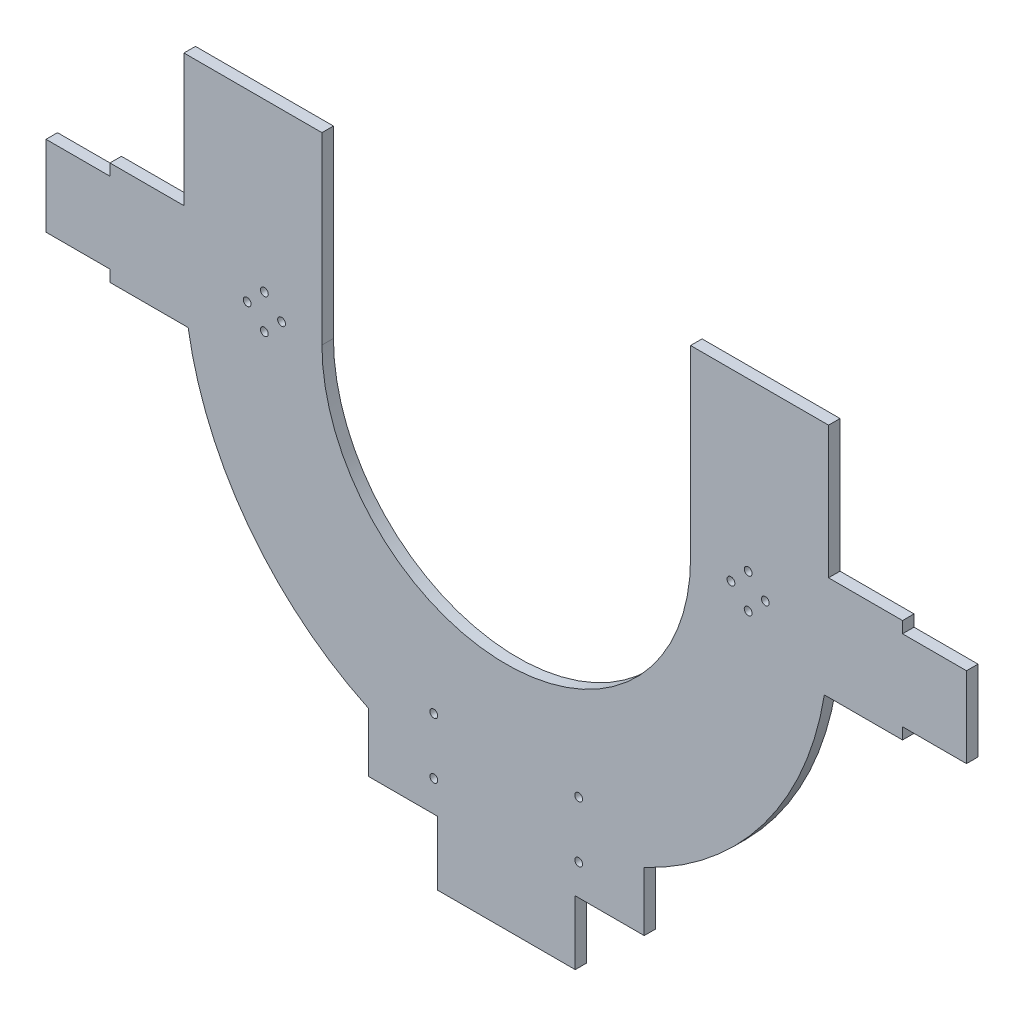
from build123d import *

# Parameters (mm, degrees)
BOSS_EXTRUDE1_DEPTH     = 3.175
SKETCH3_R               = 2.152500013
CUT_EXTRUDE2_DEPTH      = 343.063448214
CUT_EXTRUDE3_DEPTH      = 343.019240291
CUT_EXTRUDE3_DEPTH_BACK = 343.019240291
SKETCH4_R               = 2.159


with BuildPart() as part:
    # Sketch1 → Boss-Extrude1 (new, symmetric)
    with BuildSketch(Plane.XY):
        with BuildLine():
            Line((-101.800000108, 0), (-101.800000108, 101.6))
            Line((-101.800000108, 101.6), (-178.000000108, 101.6))
            Line((-178.000000108, 101.6), (-178.000000108, 28.575))
            Line((-178.000000108, 28.575), (-218.874999892, 28.575))
            Line((-218.874999892, 28.575), (-218.874999892, 22.225))
            Line((-218.874999892, 22.225), (-254.200000108, 22.225))
            Line((-254.200000108, 22.225), (-254.200000108, -22.225))
            Line((-254.200000108, -22.225), (-218.874999892, -22.225))
            Line((-218.874999892, -22.225), (-218.874999892, -28.575))
            Line((-218.874999892, -28.575), (-175.691403926, -28.575))
            ThreePointArc((-175.691403926, -28.575), (-142.258508697, -106.98839536), (-76.2, -160.865036719))
            Line((-76.2, -160.865036719), (-76.2, -193.474999892))
            Line((-76.2, -193.474999892), (-38.1, -193.474999892))
            Line((-38.1, -193.474999892), (-38.1, -228.800000108))
            Line((-38.1, -228.800000108), (38.1, -228.800000108))
            Line((38.1, -228.800000108), (38.1, -193.474999892))
            Line((38.1, -193.474999892), (76.2, -193.474999892))
            Line((76.2, -193.474999892), (76.2, -160.865036719))
            ThreePointArc((76.2, -160.865036719), (142.258508697, -106.98839536), (175.691403926, -28.575))
            Line((175.691403926, -28.575), (218.874999892, -28.575))
            Line((218.874999892, -28.575), (218.874999892, -22.225))
            Line((218.874999892, -22.225), (254.200000108, -22.225))
            Line((254.200000108, -22.225), (254.200000108, 22.225))
            Line((254.200000108, 22.225), (218.874999892, 22.225))
            Line((218.874999892, 22.225), (218.874999892, 28.575))
            Line((218.874999892, 28.575), (178.000000108, 28.575))
            Line((178.000000108, 28.575), (178.000000108, 101.6))
            Line((178.000000108, 101.6), (101.800000108, 101.6))
            Line((101.800000108, 101.6), (101.800000108, 0))
            ThreePointArc((101.800000108, 0), (0, -101.800000108), (-101.800000108, 0))
        make_face()
    extrude(amount=BOSS_EXTRUDE1_DEPTH, both=True)

    # Sketch3 → Cut-Extrude2 (cut, through all)
    with BuildSketch(Plane.XY.offset(3.175)):
        with Locations((-133.6, 9.5)):
            Circle(SKETCH3_R)
        with Locations((-124.1, 0)):
            Circle(SKETCH3_R)
        with Locations((-143.1, 0)):
            Circle(SKETCH3_R)
        with Locations((-133.6, -9.5)):
            Circle(SKETCH3_R)
        with Locations(Location((133.6, -9.5, 0), (0, 0, 180))):
            Circle(SKETCH3_R)
        with Locations(Location((143.1, 0, 0), (0, 0, 180))):
            Circle(SKETCH3_R)
        with Locations(Location((124.1, 0, 0), (0, 0, 180))):
            Circle(SKETCH3_R)
        with Locations(Location((133.6, 9.5, 0), (0, 0, 180))):
            Circle(SKETCH3_R)
    extrude(amount=-CUT_EXTRUDE2_DEPTH, mode=Mode.SUBTRACT)

    # Sketch4 → Cut-Extrude3 (cut, two sides: drawn at the far end of the back side and taken through both)
    with BuildSketch(Plane.XY.offset(-CUT_EXTRUDE3_DEPTH_BACK)):
        with Locations((40, -145.365036719)):
            Circle(SKETCH4_R)
        with Locations((-40, -145.365036719)):
            Circle(SKETCH4_R)
        with Locations((-40, -176.365036719)):
            Circle(SKETCH4_R)
        with Locations((40, -176.365036719)):
            Circle(SKETCH4_R)
    extrude(amount=CUT_EXTRUDE3_DEPTH + CUT_EXTRUDE3_DEPTH_BACK, mode=Mode.SUBTRACT)


solid = part.part
